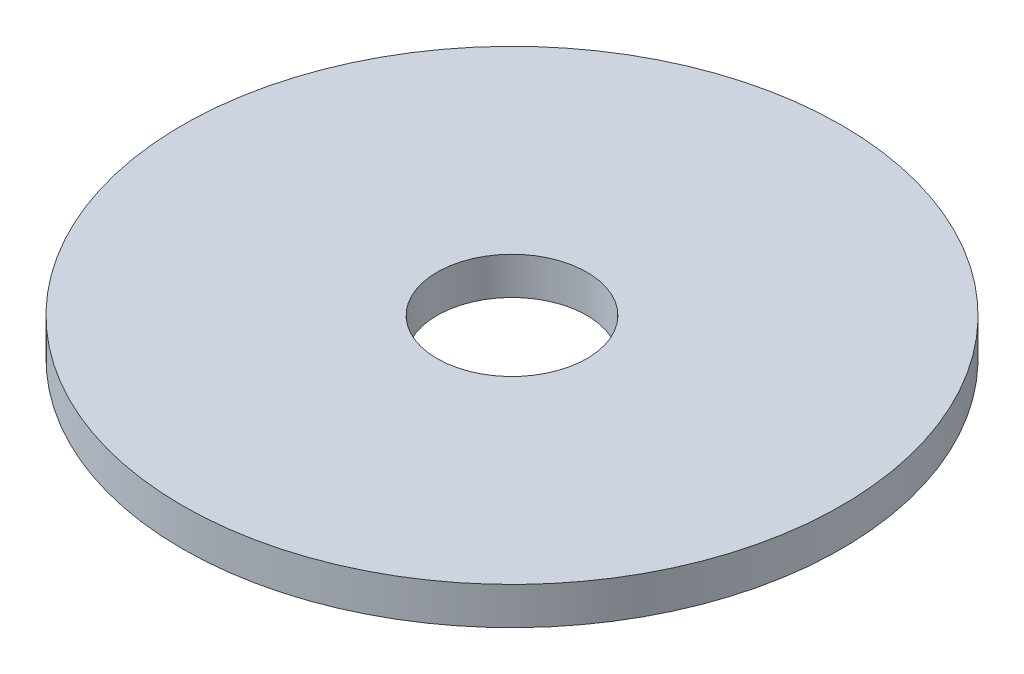
from build123d import *

# Parameters (mm, degrees)
SKETCH1_R           = 27.94
BOSS_EXTRUDE1_DEPTH = 3.175
SKETCH2_R           = 6.35
CUT_EXTRUDE1_DEPTH  = 40.640482149


with BuildPart() as part:
    # Sketch1 → Boss-Extrude1 (new body)
    with BuildSketch(Plane(origin=(0, 0, 0), x_dir=(1, 0, 0), z_dir=(0, 1, 0))):
        with Locations(Location((0, 0, 0), (0, 0, 270))):
            Circle(SKETCH1_R)
    extrude(amount=BOSS_EXTRUDE1_DEPTH)

    # Sketch2 → Cut-Extrude1 (cut, through all)
    with BuildSketch(Plane(origin=(0, 3.175, 0), x_dir=(1, 0, 0), z_dir=(0, 1, 0))):
        with Locations(Location((0, 0, 0), (0, 0, 270))):
            Circle(SKETCH2_R)
    extrude(amount=-CUT_EXTRUDE1_DEPTH, mode=Mode.SUBTRACT)


solid = part.part
